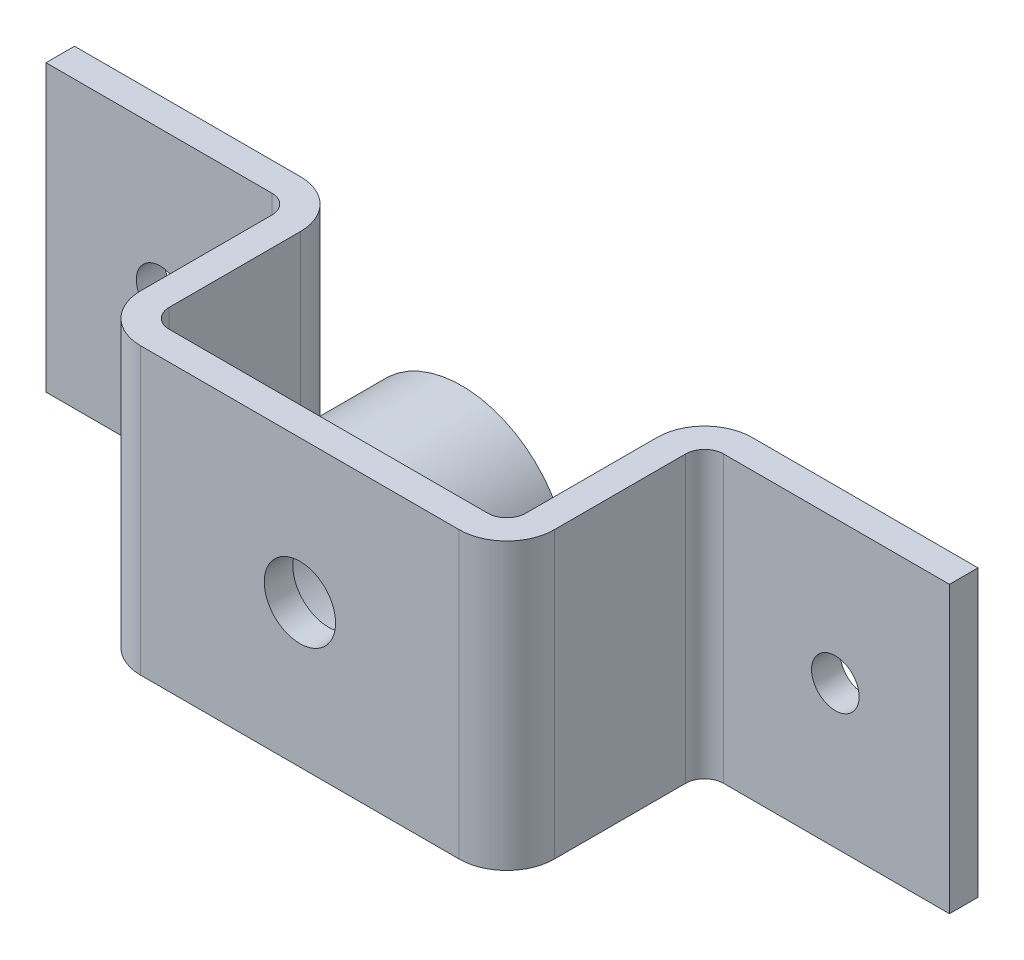
from build123d import *

# Parameters (mm, degrees)
BOSS_EXTRUDE1_DEPTH = 300
SKETCH2_R           = 112.5
BOSS_EXTRUDE2_DEPTH = 140
SKETCH3_R           = 87.5
CUT_EXTRUDE1_DEPTH  = 140
SKETCH4_R           = 37.5
CUT_EXTRUDE2_DEPTH  = 140
SKETCH5_R           = 25
CUT_EXTRUDE3_DEPTH  = 140


with BuildPart() as part:
    # Sketch1 → Boss-Extrude1 (new body)
    with BuildSketch(Plane(origin=(0, 0, 0), x_dir=(1, 0, 0), z_dir=(0, 1, 0))):
        with BuildLine():
            Line((-475, 0), (-237.5, 0))
            ThreePointArc((-237.5, 0), (-202.144660941, -14.644660941), (-187.5, -50))
            Line((-187.5, -50), (-187.5, -188))
            ThreePointArc((-187.5, -188), (-181.642135624, -202.142135624), (-167.5, -208))
            Line((-167.5, -208), (167.5, -208))
            ThreePointArc((167.5, -208), (181.642135624, -202.142135624), (187.5, -188))
            Line((187.5, -188), (187.5, -50))
            ThreePointArc((187.5, -50), (202.144660941, -14.644660941), (237.5, 0))
            Line((237.5, 0), (475, 0))
            Line((475, 0), (475, -30))
            Line((475, -30), (237.5, -30))
            ThreePointArc((237.5, -30), (223.357864376, -35.857864376), (217.5, -50))
            Line((217.5, -50), (217.5, -188))
            ThreePointArc((217.5, -188), (202.855339059, -223.355339059), (167.5, -238))
            Line((167.5, -238), (-167.5, -238))
            ThreePointArc((-167.5, -238), (-202.855339059, -223.355339059), (-217.5, -188))
            Line((-217.5, -188), (-217.5, -50))
            ThreePointArc((-217.5, -50), (-223.357864376, -35.857864376), (-237.5, -30))
            Line((-237.5, -30), (-475, -30))
            Line((-475, -30), (-475, 0))
        make_face()
    extrude(amount=BOSS_EXTRUDE1_DEPTH)

    # Sketch2 → Boss-Extrude2 (add)
    with BuildSketch(Plane(origin=(0, 0, 208), x_dir=(-1, 0, 0), z_dir=(0, 0, -1))):
        with Locations(Location((0, 150, 0), (0, 0, 180))):
            Circle(SKETCH2_R)
    extrude(amount=BOSS_EXTRUDE2_DEPTH)

    # Sketch3 → Cut-Extrude1 (cut)
    with BuildSketch(Plane(origin=(0, 0, 68), x_dir=(-1, 0, 0), z_dir=(0, 0, -1))):
        with Locations((0, 150)):
            Circle(SKETCH3_R)
    extrude(amount=-CUT_EXTRUDE1_DEPTH, mode=Mode.SUBTRACT)

    # Sketch4 → Cut-Extrude2 (cut)
    with BuildSketch(Plane(origin=(0, 0, 208), x_dir=(-1, 0, 0), z_dir=(0, 0, -1))):
        with Locations((0, 150)):
            Circle(SKETCH4_R)
    extrude(amount=-CUT_EXTRUDE2_DEPTH, mode=Mode.SUBTRACT)

    # Sketch5 → Cut-Extrude3 (cut)
    with BuildSketch(Plane(origin=(0, 0, 0), x_dir=(-1, 0, 0), z_dir=(0, 0, -1))):
        with Locations((-355, 150)):
            Circle(SKETCH5_R)
        with Locations((355, 150)):
            Circle(SKETCH5_R)
    extrude(amount=-CUT_EXTRUDE3_DEPTH, mode=Mode.SUBTRACT)


solid = part.part
